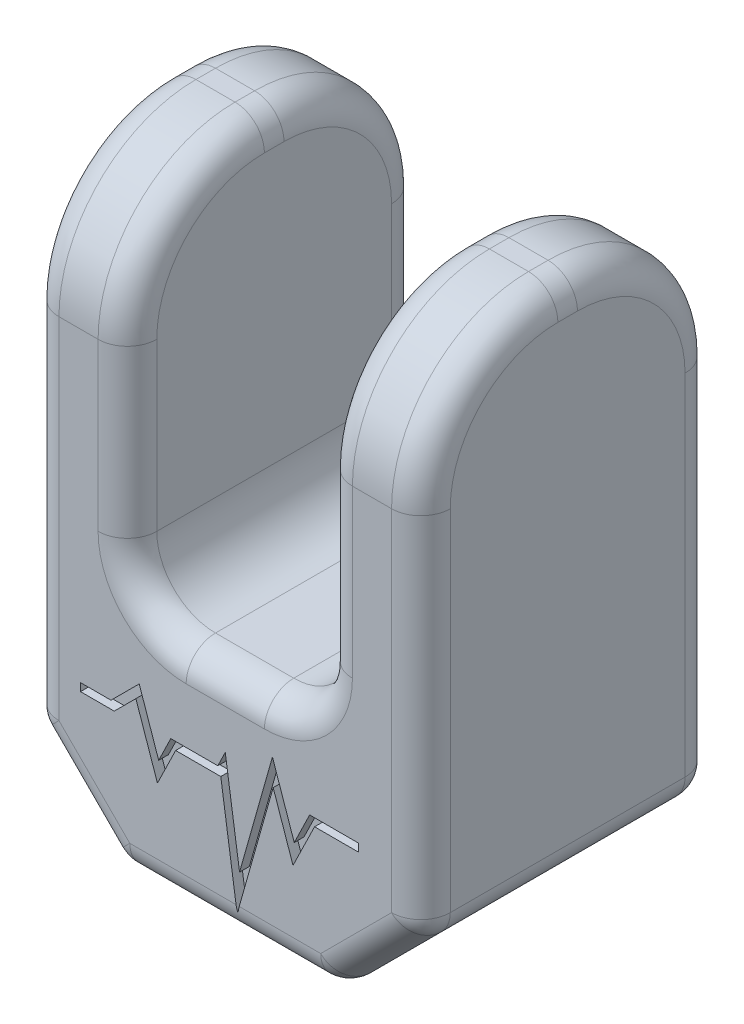
from build123d import *

# Parameters (mm, degrees)
ESQUISSE1_W             = 20
ESQUISSE1_H             = 30
BOSS_EXTRU_1_DEPTH      = 15
CONG_1_R                = 7
ESQUISSE2_W             = 10
ESQUISSE2_H             = 15
ENL_V_MAT_EXTRU_1_DEPTH = 18.5
CONG_2_R                = 3
CONG_3_R                = 1.5
CHANFREIN1_SIZE         = 4.5
CONG_4_R                = 1.5
ENL_V_MAT_EXTRU_2_DEPTH = 0.5
ENL_V_MAT_EXTRU_3_DEPTH = 0.5


with BuildPart() as part:
    # Esquisse1 → Boss.-Extru.1 (new body)
    with BuildSketch(Plane.XY):
        Rectangle(ESQUISSE1_W, ESQUISSE1_H)
    extrude(amount=BOSS_EXTRU_1_DEPTH)

    # Congé1
    cong_1_edges = [part.edges().sort_by_distance(p)[0] for p in [
        (0, 15, 0),
        (0, 15, 15),
    ]]
    fillet(cong_1_edges, radius=CONG_1_R)

    # Esquisse2 → Enlèv. mat.-Extru.1 (cut)
    with BuildSketch(Plane(origin=(0, 15, 0), x_dir=(1, 0, 0), z_dir=(0, 1, 0))):
        with Locations((0, -7.5)):
            Rectangle(ESQUISSE2_W, ESQUISSE2_H)
    extrude(amount=-ENL_V_MAT_EXTRU_1_DEPTH, mode=Mode.SUBTRACT)

    # Congé2
    cong_2_edges = [part.edges().sort_by_distance(p)[0] for p in [
        (5, -3.5, 7.5),
        (-5, -3.5, 7.5),
    ]]
    fillet(cong_2_edges, radius=CONG_2_R)

    # Congé3
    cong_3_edges = [part.edges().sort_by_distance(p)[0] for p in [
        (-5, 12.949747468, 12.949747468),
        (5, 12.949747468, 12.949747468),
        (5, 12.949747468, 2.050252532),
        (-5, 12.949747468, 2.050252532),
        (-5, 15, 7.5),
        (5, 15, 7.5),
        (0, -3.5, 0),
        (0, -3.5, 15),
        (-5, 3.75, 15),
        (-5, 3.75, 0),
        (5, 3.75, 0),
        (5, 3.75, 15),
        (-4.121320344, -2.621320344, 15),
        (-4.121320344, -2.621320344, 0),
        (4.121320344, -2.621320344, 0),
        (4.121320344, -2.621320344, 15),
    ]]
    fillet(cong_3_edges, radius=CONG_3_R)

    # Chanfrein1
    chanfrein1_edges = [part.edges().sort_by_distance(p)[0] for p in [
        (10, -15, 7.5),
        (-10, -15, 7.5),
    ]]
    chamfer(chanfrein1_edges, length=CHANFREIN1_SIZE)

    # Congé4
    cong_4_edges = [part.edges().sort_by_distance(p)[0] for p in [
        (10, -1.25, 0),
        (10, -1.25, 15),
        (10, -10.5, 7.5),
        (0, -15, 0),
        (-7.75, -12.75, 0),
        (7.75, -12.75, 0),
        (0, -15, 15),
        (-5.5, -15, 7.5),
        (5.5, -15, 7.5),
        (-7.75, -12.75, 15),
        (7.75, -12.75, 15),
        (-10, -10.5, 7.5),
        (-10, 15, 7.5),
        (10, 15, 7.5),
        (-10, -1.25, 0),
        (-10, -1.25, 15),
        (-10, 12.949747468, 12.949747468),
        (-10, 12.949747468, 2.050252532),
        (10, 12.949747468, 12.949747468),
        (10, 12.949747468, 2.050252532),
    ]]
    fillet(cong_4_edges, radius=CONG_4_R)

    # Esquisse3 → Enlèv. mat.-Extru.2 (cut)
    with BuildSketch(Plane.XY.offset(15)):
        Polygon((6.799705196, -7.645408133), (4.313330171, -7.645408133), (3.525434873, -9.2634614), (2.411418382, -6.034839284), (0.730170893, -11.971446212), (0, -7.035440736), (-0.380916703, -7.817706498), (-2.785361583, -7.817706498), (-3.403636623, -9.087420826), (-4.398752101, -6.20339544), (-5.840764794, -7.645408133), (-7.399157136, -7.645408133), (-7.399157136, -8.045408133), (-5.675079369, -8.045408133), (-4.568230072, -6.938558836), (-3.466779638, -10.130762237), (-2.535235756, -8.217706498), (-0.22946322, -8.217706498), (0.607203371, -13.873630222), (2.449002124, -7.370105128), (3.462291858, -10.306802811), (4.563455998, -8.045408133), (6.799705196, -8.045408133), align=None)
    extrude(amount=-ENL_V_MAT_EXTRU_2_DEPTH, mode=Mode.SUBTRACT)

    # Esquisse4 → Enlèv. mat.-Extru.3 (cut)
    with BuildSketch(Plane.ZY.offset(10)):
        with BuildLine():
            Line((9.241265037, 9.282942777), (8, 10.85264875))
            Line((8, 10.85264875), (6.758734963, 9.282942777))
            ThreePointArc((6.758734963, 9.282942777), (6.827029099, 8.109971877), (8, 8.04167774))
            ThreePointArc((8, 8.04167774), (9.172970901, 8.109971877), (9.241265037, 9.282942777))
        make_face()
    extrude(amount=-ENL_V_MAT_EXTRU_3_DEPTH, mode=Mode.SUBTRACT)


solid = part.part
